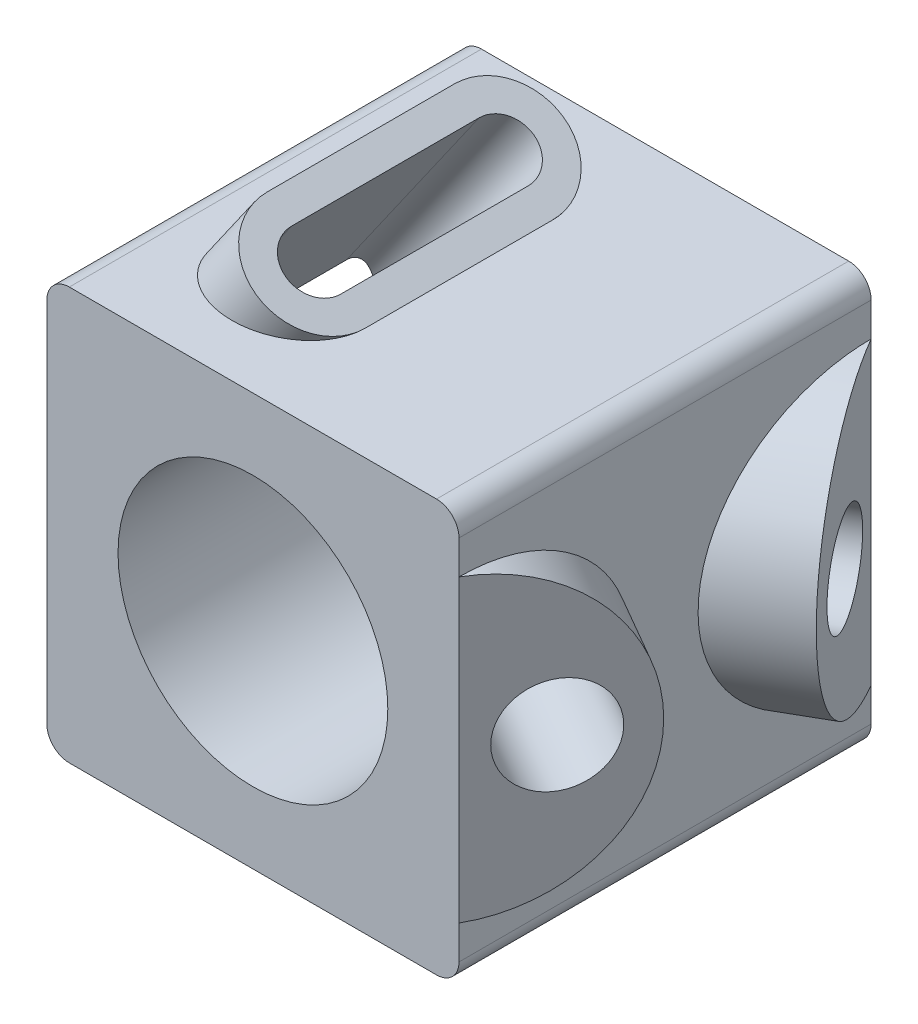
from build123d import *

# Parameters (mm, degrees)
SKETCH1_W               = 139.7
SKETCH1_H               = 139.7
BOSS_EXTRUDE1_DEPTH     = 139.7
FILLET1_R               = 7.62
FILLET2_R               = 7.62
BOSS_EXTRUDE3_REACH     = 210.999
CUT_EXTRUDE2_DEPTH      = 209.804
SKETCH9_R               = 45.72
CUT_EXTRUDE3_DEPTH      = 209.804
BOSS_EXTRUDE4_REACH     = 231.134
CUT_EXTRUDE4_REACH      = 231.134
CUT_EXTRUDE4_END_RADIUS = 45.72
SKETCH11_R              = 16.51


with BuildPart() as part:
    # Sketch1 → Boss-Extrude1 (new body)
    with BuildSketch(Plane.XY):
        Rectangle(SKETCH1_W, SKETCH1_H)
    extrude(amount=BOSS_EXTRUDE1_DEPTH)

    # Fillet1
    fillet1_edges = [part.edges().sort_by_distance(p)[0] for p in [
        (-69.85, 69.85, 69.85),
    ]]
    fillet(fillet1_edges, radius=FILLET1_R)

    # Fillet2
    fillet2_edges = [part.edges().sort_by_distance(p)[0] for p in [
        (69.85, -69.85, 69.85),
        (-69.85, -69.85, 69.85),
        (69.85, 69.85, 69.85),
    ]]
    fillet(fillet2_edges, radius=FILLET2_R)

    # Sketch6 → Boss-Extrude3 (add, up to next)
    with BuildSketch(Plane(origin=(32.818764781, 46.870053506, 0), x_dir=(0, 0, 1), z_dir=(0.5735764363510473, 0.819152044288991, 0)), mode=Mode.PRIVATE) as boss_extrude3_sk1:
        with BuildLine():
            Line((38.072922524, -40.064314079), (101.627077476, -40.064314079))
            ThreePointArc((101.627077476, -40.064314079), (121.947077476, -60.384314079), (101.627077476, -80.704314079))
            Line((101.627077476, -80.704314079), (38.072922524, -80.704314079))
            ThreePointArc((38.072922524, -80.704314079), (17.752922524, -60.384314079), (38.072922524, -40.064314079))
        make_face()
    boss_extrude3_tool1 = extrude(boss_extrude3_sk1.sketch, amount=-BOSS_EXTRUDE3_REACH, mode=Mode.PRIVATE) - part.part
    add(boss_extrude3_tool1.solids().sort_by_distance((-16.64517, 81.505073, 69.85))[0])

    # Sketch8 → Cut-Extrude2 (cut)
    with BuildSketch(Plane(origin=(32.818764781, 46.870053506, 0), x_dir=(0.819152044288991, -0.5735764363510474, 0), z_dir=(0.5735764363510474, 0.819152044288991, 0))):
        with BuildLine():
            Line((-70.544314079, -101.627077476), (-70.544314079, -38.072922524))
            ThreePointArc((-70.544314079, -38.072922524), (-60.384314079, -27.912922524), (-50.224314079, -38.072922524))
            Line((-50.224314079, -38.072922524), (-50.224314079, -101.627077476))
            ThreePointArc((-50.224314079, -101.627077476), (-60.384314079, -111.787077476), (-70.544314079, -101.627077476))
        make_face()
    extrude(amount=-CUT_EXTRUDE2_DEPTH, mode=Mode.SUBTRACT)

    # Sketch9 → Cut-Extrude3 (cut)
    with BuildSketch(Plane.XY.offset(139.7)):
        Circle(SKETCH9_R)
    extrude(amount=-CUT_EXTRUDE3_DEPTH, mode=Mode.SUBTRACT)

    # Boss-Extrude4: up to this face of the body (flat: up to its plane)
    boss_extrude4_end = Plane(part.part.faces().sort_by_distance((69.85, 0, 69.85))[0])
    # Sketch10 → Boss-Extrude4 (add, up to the picked face)
    with BuildSketch(Plane(origin=(52.3875, 0, -30.245937227), x_dir=(0, 1, 0), z_dir=(0.866025403784438, 0, -0.5000000000000009)), mode=Mode.PRIVATE) as boss_extrude4_sk1:
        with BuildLine():
            Line((-50.8, 34.925), (50.8, 34.925))
            ThreePointArc((50.8, 34.925), (0, 85.725), (-50.8, 34.925))
        make_face()
    boss_extrude4_tool1 = split(extrude(boss_extrude4_sk1.sketch, amount=-BOSS_EXTRUDE4_REACH, mode=Mode.PRIVATE), bisect_by=boss_extrude4_end, keep=Keep.BOTH, mode=Mode.PRIVATE)
    boss_extrude4 = boss_extrude4_tool1.solids().sort_by(Axis((80.630095, 0, 18.671672), (-0.866025403784438, 0, 0.5000000000000009)))[0]
    add(boss_extrude4)

    # Cut-Extrude4: up to this cylinder (the profile starts outside it)
    cut_extrude4_end = Plane(origin=(0, 0, 21.117163), z_dir=(0, 0, 1)) * Cylinder(CUT_EXTRUDE4_END_RADIUS, 554.708, mode=Mode.PRIVATE)
    # Sketch11 → Cut-Extrude4 (cut, up to the surface)
    with BuildSketch(Plane(origin=(52.3875, 0, -30.245937227), x_dir=(-0.5000000000000012, 0, -0.866025403784438), z_dir=(0.8660254037844379, 0, -0.5000000000000011)), mode=Mode.PRIVATE) as cut_extrude4_sk1:
        with Locations((-59.309, 0)):
            Circle(SKETCH11_R)
    cut_extrude4_tool1 = extrude(cut_extrude4_sk1.sketch, amount=-CUT_EXTRUDE4_REACH, mode=Mode.PRIVATE) - cut_extrude4_end
    cut_extrude4 = cut_extrude4_tool1.solids().sort_by_distance((82.042, 0, 21.117163))[0]
    add(cut_extrude4, mode=Mode.SUBTRACT)

    # Mirror1: Boss-Extrude4, Cut-Extrude4 across plane
    add(boss_extrude4.mirror(Plane.XY.offset(69.85)))
    add(cut_extrude4.mirror(Plane.XY.offset(69.85)), mode=Mode.SUBTRACT)


solid = part.part
